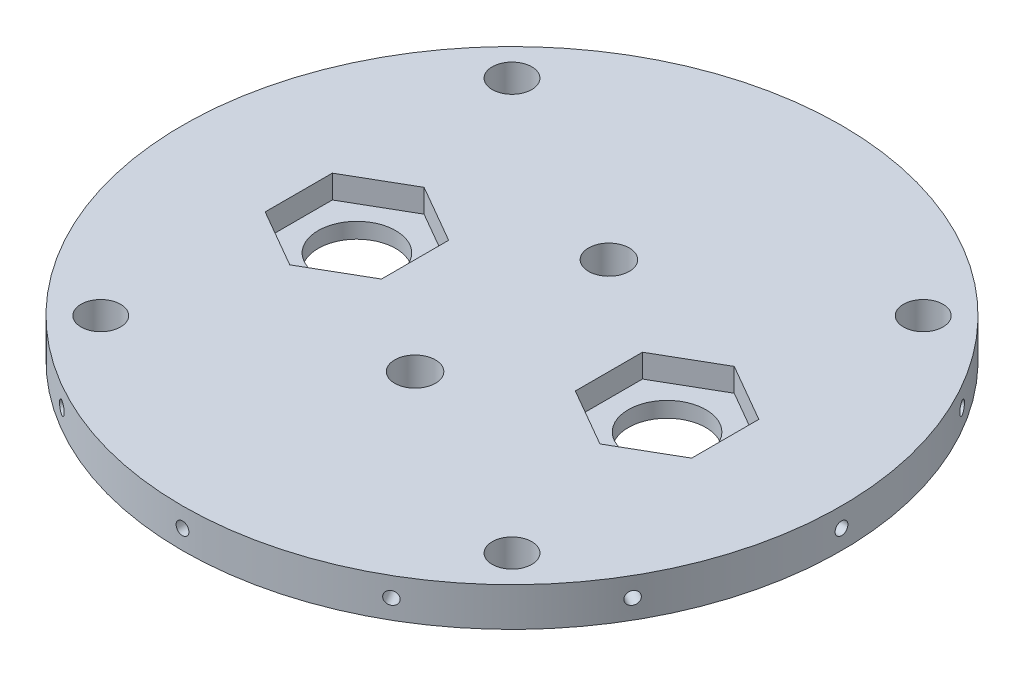
from build123d import *

# Parameters (mm, degrees)
SZKIC1_R                    = 85
DODANIE_WYCI_GNI_CIE1_DEPTH = 10
CUT_EXTRUDE1_REACH          = 122.623
SZKIC2_R                    = 10
SZKIC2_R_2                  = 5.25
SZKIC2_R_3                  = 5.1
CUT_EXTRUDE2_DEPTH          = 6
SKETCH2_R                   = 1.65
CUT_EXTRUDE3_DEPTH          = 12
CIRPATTERN1_COUNT           = 12


with BuildPart() as part:
    # Szkic1 → Dodanie-wyciągnięcie1 (new body)
    with BuildSketch(Plane(origin=(0, 0, 0), x_dir=(1, 0, 0), z_dir=(0, 1, 0))):
        with Locations(Location((0, 0, 0), (0, 0, 270))):
            Circle(SZKIC1_R)
    extrude(amount=DODANIE_WYCI_GNI_CIE1_DEPTH)

    # Szkic2 → Cut-Extrude1 (cut, up to next)
    with BuildSketch(Plane(origin=(0, 10, 0), x_dir=(1, 0, 0), z_dir=(0, 1, 0)), mode=Mode.PRIVATE) as cut_extrude1_sk1:
        with Locations(Location((-40, 0, 0), (0, 0, 270))):
            Circle(SZKIC2_R)
    cut_extrude1_tool1 = extrude(cut_extrude1_sk1.sketch, amount=-CUT_EXTRUDE1_REACH, mode=Mode.PRIVATE) & part.part
    # Szkic2 → Cut-Extrude1 (cut, up to next)
    with BuildSketch(Plane(origin=(0, 10, 0), x_dir=(1, 0, 0), z_dir=(0, 1, 0)), mode=Mode.PRIVATE) as cut_extrude1_sk2:
        with Locations(Location((0, 25, 0), (0, 0, 270))):
            Circle(SZKIC2_R_2)
    cut_extrude1_tool2 = extrude(cut_extrude1_sk2.sketch, amount=-CUT_EXTRUDE1_REACH, mode=Mode.PRIVATE) & part.part
    # Szkic2 → Cut-Extrude1 (cut, up to next)
    with BuildSketch(Plane(origin=(0, 10, 0), x_dir=(1, 0, 0), z_dir=(0, 1, 0)), mode=Mode.PRIVATE) as cut_extrude1_sk3:
        with Locations(Location((53.033008589, 53.033008589, 0), (0, 0, 270))):
            Circle(SZKIC2_R_3)
    cut_extrude1_tool3 = extrude(cut_extrude1_sk3.sketch, amount=-CUT_EXTRUDE1_REACH, mode=Mode.PRIVATE) & part.part
    # Szkic2 → Cut-Extrude1 (cut, up to next)
    with BuildSketch(Plane(origin=(0, 10, 0), x_dir=(1, 0, 0), z_dir=(0, 1, 0)), mode=Mode.PRIVATE) as cut_extrude1_sk4:
        with Locations(Location((53.033008589, -53.033008589, 0), (0, 0, 270))):
            Circle(SZKIC2_R_3)
    cut_extrude1_tool4 = extrude(cut_extrude1_sk4.sketch, amount=-CUT_EXTRUDE1_REACH, mode=Mode.PRIVATE) & part.part
    # Szkic2 → Cut-Extrude1 (cut, up to next)
    with BuildSketch(Plane(origin=(0, 10, 0), x_dir=(1, 0, 0), z_dir=(0, 1, 0)), mode=Mode.PRIVATE) as cut_extrude1_sk5:
        with Locations(Location((-53.033008589, -53.033008589, 0), (0, 0, 270))):
            Circle(SZKIC2_R_3)
    cut_extrude1_tool5 = extrude(cut_extrude1_sk5.sketch, amount=-CUT_EXTRUDE1_REACH, mode=Mode.PRIVATE) & part.part
    # Szkic2 → Cut-Extrude1 (cut, up to next)
    with BuildSketch(Plane(origin=(0, 10, 0), x_dir=(1, 0, 0), z_dir=(0, 1, 0)), mode=Mode.PRIVATE) as cut_extrude1_sk6:
        with Locations(Location((-53.033008589, 53.033008589, 0), (0, 0, 270))):
            Circle(SZKIC2_R_3)
    cut_extrude1_tool6 = extrude(cut_extrude1_sk6.sketch, amount=-CUT_EXTRUDE1_REACH, mode=Mode.PRIVATE) & part.part
    # Szkic2 → Cut-Extrude1 (cut, up to next)
    with BuildSketch(Plane(origin=(0, 10, 0), x_dir=(1, 0, 0), z_dir=(0, 1, 0)), mode=Mode.PRIVATE) as cut_extrude1_sk7:
        with Locations(Location((0, -25, 0), (0, 0, 270))):
            Circle(SZKIC2_R_2)
    cut_extrude1_tool7 = extrude(cut_extrude1_sk7.sketch, amount=-CUT_EXTRUDE1_REACH, mode=Mode.PRIVATE) & part.part
    # Szkic2 → Cut-Extrude1 (cut, up to next)
    with BuildSketch(Plane(origin=(0, 10, 0), x_dir=(1, 0, 0), z_dir=(0, 1, 0)), mode=Mode.PRIVATE) as cut_extrude1_sk8:
        with Locations(Location((40, 0, 0), (0, 0, 270))):
            Circle(SZKIC2_R)
    cut_extrude1_tool8 = extrude(cut_extrude1_sk8.sketch, amount=-CUT_EXTRUDE1_REACH, mode=Mode.PRIVATE) & part.part
    add(cut_extrude1_tool1.solids().sort_by_distance((-40, 10, 0))[0], mode=Mode.SUBTRACT)
    add(cut_extrude1_tool2.solids().sort_by_distance((0, 10, -25))[0], mode=Mode.SUBTRACT)
    add(cut_extrude1_tool3.solids().sort_by_distance((53.033009, 10, -53.033009))[0], mode=Mode.SUBTRACT)
    add(cut_extrude1_tool4.solids().sort_by_distance((53.033009, 10, 53.033009))[0], mode=Mode.SUBTRACT)
    add(cut_extrude1_tool5.solids().sort_by_distance((-53.033009, 10, 53.033009))[0], mode=Mode.SUBTRACT)
    add(cut_extrude1_tool6.solids().sort_by_distance((-53.033009, 10, -53.033009))[0], mode=Mode.SUBTRACT)
    add(cut_extrude1_tool7.solids().sort_by_distance((0, 10, 25))[0], mode=Mode.SUBTRACT)
    add(cut_extrude1_tool8.solids().sort_by_distance((40, 10, 0))[0], mode=Mode.SUBTRACT)

    # Sketch1 → Cut-Extrude2 (cut)
    with BuildSketch(Plane(origin=(0, 10, 0), x_dir=(1, 0, 0), z_dir=(0, 1, 0))):
        Polygon((-25, -8.660254038), (-25, 8.660254038), (-40, 17.320508076), (-55, 8.660254038), (-55, -8.660254038), (-40, -17.320508076), align=None)
        Polygon((25, -8.660254038), (40, -17.320508076), (55, -8.660254038), (55, 8.660254038), (40, 17.320508076), (25, 8.660254038), align=None)
    extrude(amount=-CUT_EXTRUDE2_DEPTH, mode=Mode.SUBTRACT)

    # Sketch2 → Cut-Extrude3 (cut)
    with BuildSketch(Plane.ZY.offset(85)):
        with Locations((0, 5)):
            Circle(SKETCH2_R)
    cut_extrude3 = extrude(amount=-CUT_EXTRUDE3_DEPTH, mode=Mode.SUBTRACT)

    # CirPattern1: Cut-Extrude3 ×12 about axis
    cirpattern1_axis = Axis((0, 0, 0), (0, 1, 0))
    for i in range(1, CIRPATTERN1_COUNT):
        add(cut_extrude3.rotate(cirpattern1_axis, i * 360 / CIRPATTERN1_COUNT), mode=Mode.SUBTRACT)


solid = part.part
